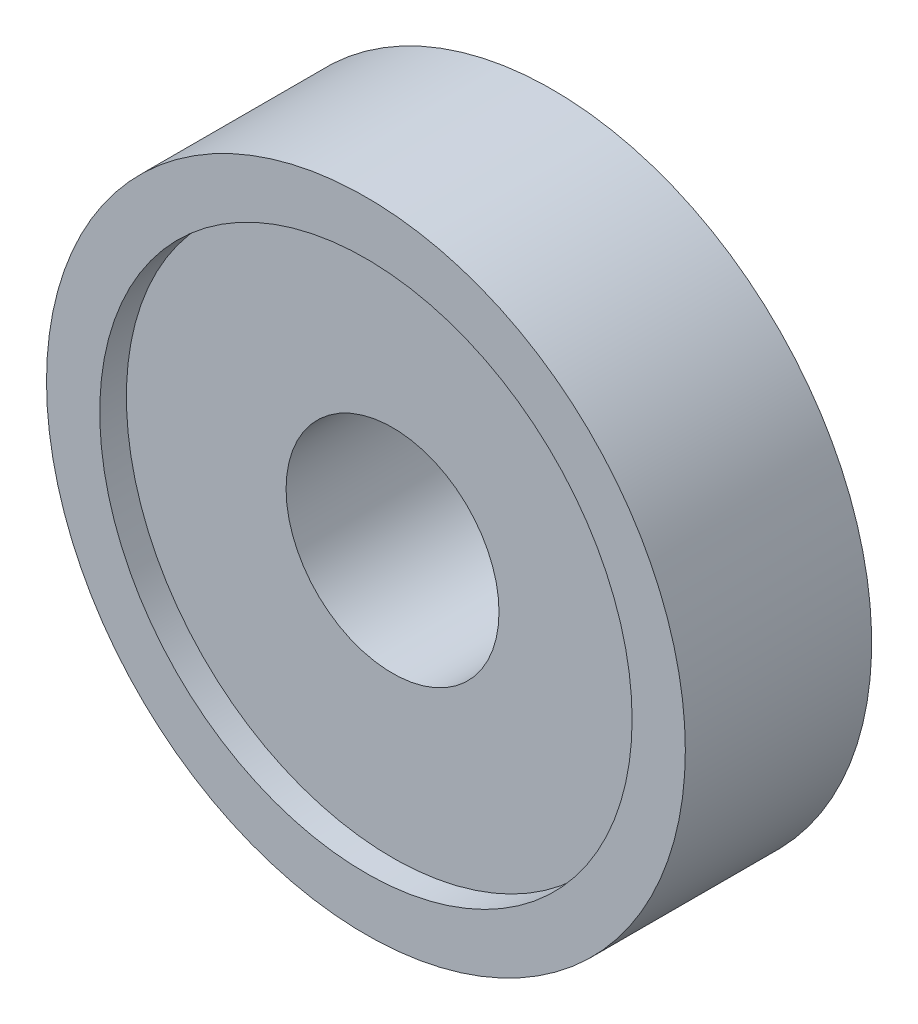
from build123d import *

# Parameters (mm, degrees)
SKETCH1_R           = 12
SKETCH1_R_2         = 10
BOSS_EXTRUDE1_DEPTH = 1
BOSS_EXTRUDE2_START = 6
SKETCH2_R           = 12
BOSS_EXTRUDE2_DEPTH = 6
SKETCH3_R           = 4
CUT_EXTRUDE1_DEPTH  = 13


with BuildPart() as part:
    # Sketch1 → Boss-Extrude1 (new body)
    with BuildSketch(Plane(origin=(0, 0, 0), x_dir=(0, 1, 0), z_dir=(0, 0, 1))):
        with Locations(Location((0, 0, 0), (0, 0, 270))):
            Circle(SKETCH1_R)
        with Locations(Location((0, 0, 0), (0, 0, 270))):
            Circle(SKETCH1_R_2, mode=Mode.SUBTRACT)
    extrude(amount=BOSS_EXTRUDE1_DEPTH)

    # Sketch2 → Boss-Extrude2 (add)
    with BuildSketch(Plane(origin=(0, 0, 0), x_dir=(1, 0, 0), z_dir=(0, 0, -1)).offset(BOSS_EXTRUDE2_START)):
        with Locations(Location((0, 0, 0), (0, 0, 180))):
            Circle(SKETCH2_R)
    extrude(amount=-BOSS_EXTRUDE2_DEPTH)

    # Sketch3 → Cut-Extrude1 (cut)
    with BuildSketch(Plane.XY):
        Circle(SKETCH3_R)
    extrude(amount=-CUT_EXTRUDE1_DEPTH, mode=Mode.SUBTRACT)


solid = part.part
